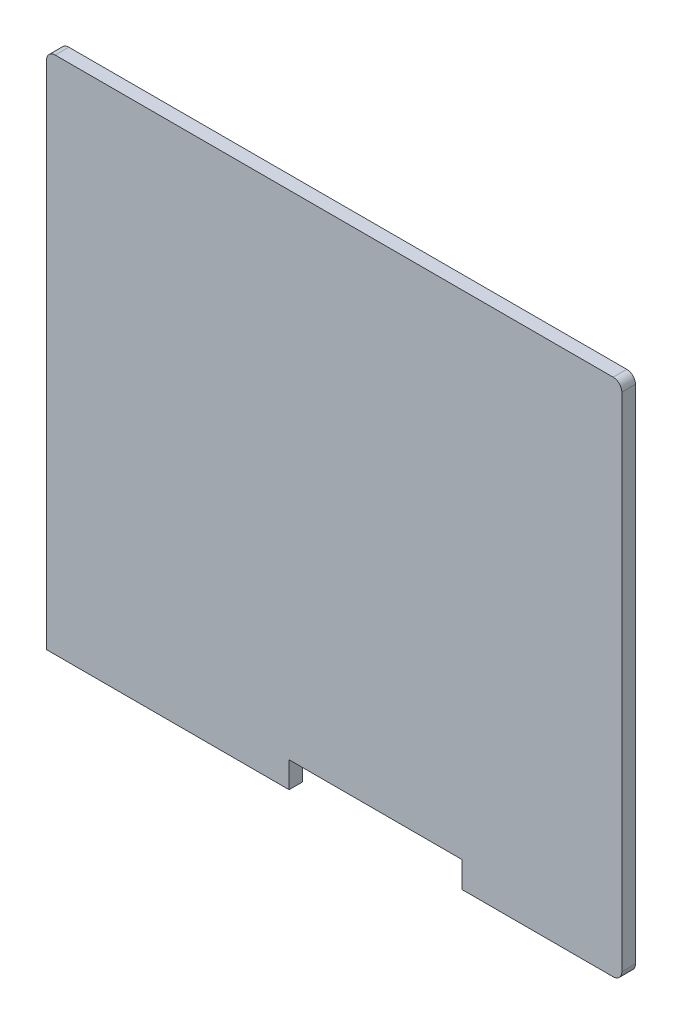
from build123d import *

# Parameters (mm, degrees)
BOSS_EXTRUDE1_DEPTH = 1.5748


with BuildPart() as part:
    # BPR2 PCB Outline → Boss-Extrude1 (new body)
    with BuildSketch(Plane.XY):
        with BuildLine():
            Line((83.596984325, 7.317563979), (83.596984325, 10.317563979))
            Line((83.596984325, 10.317563979), (103.596984325, 10.317563979))
            Line((103.596984325, 10.317563979), (103.596984325, 7.317563979))
            Line((103.596984325, 7.317563979), (121.040984325, 7.317563979))
            ThreePointArc((121.040984325, 7.317563979), (121.748091106, 7.610457198), (122.040984325, 8.317563979))
            Line((122.040984325, 8.317563979), (122.040984325, 66.317563979))
            ThreePointArc((122.040984325, 66.317563979), (121.748091106, 67.02467076), (121.040984325, 67.317563979))
            Line((121.040984325, 67.317563979), (56.570984325, 67.317563979))
            ThreePointArc((56.570984325, 67.317563979), (55.863877543, 67.02467076), (55.570984325, 66.317563979))
            Line((55.570984325, 66.317563979), (55.570984325, 7.317563979))
            Line((55.570984325, 7.317563979), (83.596984325, 7.317563979))
        make_face()
    extrude(amount=-BOSS_EXTRUDE1_DEPTH)


solid = part.part
